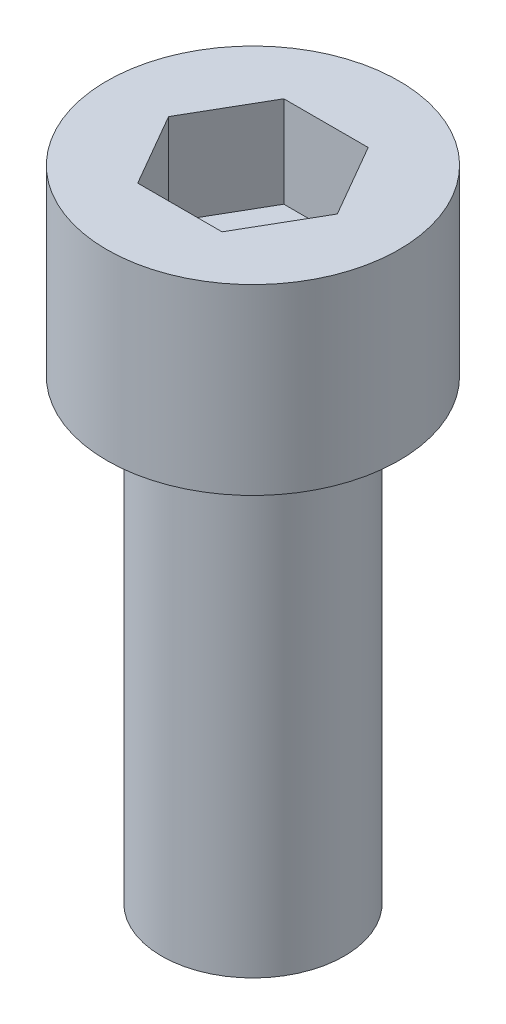
from build123d import *

# Parameters (mm, degrees)
CUT_EXTRUDE1_DEPTH = 5


with BuildPart() as part:
    # Sketch1 → Revolve1 (revolve)
    with BuildSketch(Plane.XY, mode=Mode.PRIVATE) as revolve1_sk:
        Polygon((0, -25), (5, -25), (5, 0), (8, 0), (8, 10), (0, 10), align=None)
    revolve(revolve1_sk.sketch.rotate(Axis((0, 61.691642626, 0), (0, -1, 0)), 90), axis=Axis((0, 61.691642626, 0), (0, -1, 0)))

    # Sketch2 → Cut-Extrude1 (cut)
    with BuildSketch(Plane(origin=(0, 10, 0), x_dir=(-1, 0, 0), z_dir=(0, 1, 0))):
        Polygon((-2.309401077, -4), (2.309401077, -4), (4.618802154, 0), (2.309401077, 4), (-2.309401077, 4), (-4.618802154, 0), align=None)
    extrude(amount=-CUT_EXTRUDE1_DEPTH, mode=Mode.SUBTRACT)

    # Sketch3 → O-ring relief in hole (revolve)
    with BuildSketch(Plane.XY, mode=Mode.PRIVATE) as o_ring_relief_in_hole_sk:
        Polygon((0, 0), (5.5, 0), (5.5, -1.5), (0, -4.936781436), align=None)
    revolve(o_ring_relief_in_hole_sk.sketch.rotate(Axis((0, 0, 0), (0, -1, 0)), 90), axis=Axis((0, 0, 0), (0, -1, 0)))


solid = part.part
